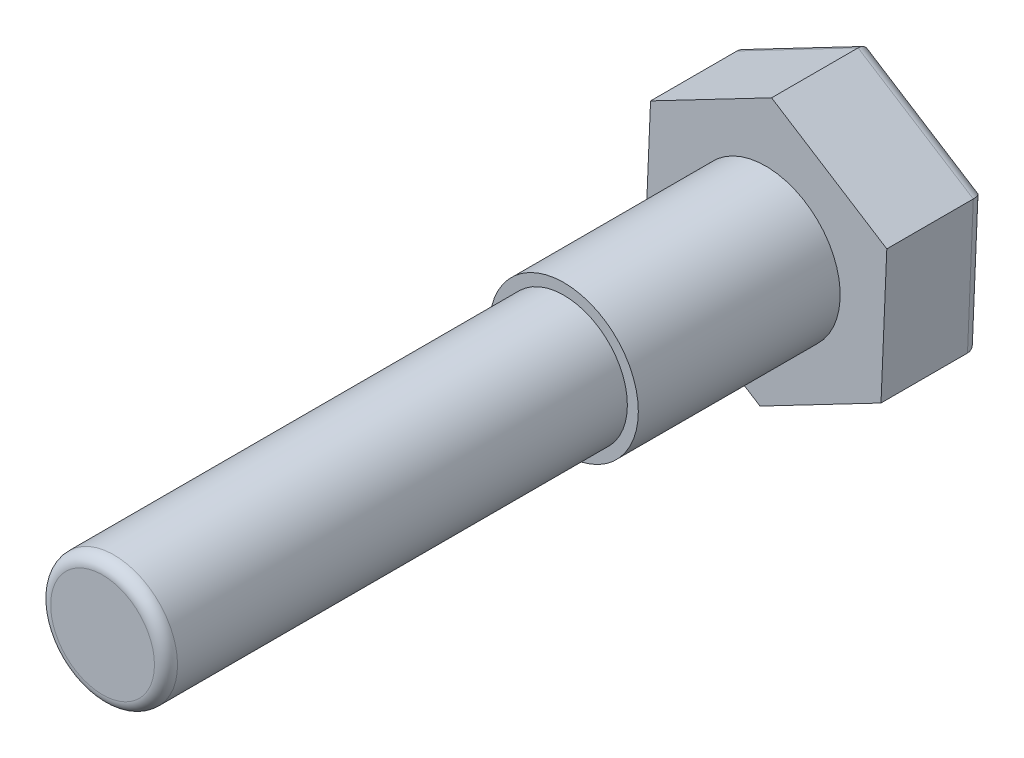
from build123d import *

# Parameters (mm, degrees)
EXTRUDE_376_DEPTH = 17
SKETCH_2_R        = 12.9
EXTRUDE_1_DEPTH   = 35
FILLET_3_R        = 2
SKETCH_3_R        = 11
EXTRUDE_2_DEPTH   = 80
FILLET_4_R        = 2


with BuildPart() as part:
    # 草图1 → Extrude 376 (new body)
    with BuildSketch(Plane.XY):
        Polygon((20.984201837, 10.954296262), (1.005402075, 23.65), (-19.978799762, 12.695703738), (-20.984201837, -10.954296262), (-1.005402075, -23.65), (19.978799762, -12.695703738), align=None)
    extrude(amount=EXTRUDE_376_DEPTH)

    # 草图2 → 凸台-拉伸1 (add)
    with BuildSketch(Plane.XY.offset(17)):
        with Locations(Location((0, 0, 0), (0, 0, 180))):
            Circle(SKETCH_2_R)
    extrude(amount=EXTRUDE_1_DEPTH)

    # 圆角3
    fillet_3_edges = [part.edges().sort_by_distance(p)[0] for p in [
        (9.486698843, -18.172851869, 0),
        (-10.994801956, -17.302148131, 0),
        (-20.4815008, 0.870703738, 0),
        (-9.486698843, 18.172851869, 0),
        (10.994801956, 17.302148131, 0),
        (20.4815008, -0.870703738, 0),
    ]]
    fillet(fillet_3_edges, radius=FILLET_3_R)

    # 草图3 → 凸台-拉伸2 (add)
    with BuildSketch(Plane.XY.offset(52)):
        Circle(SKETCH_3_R)
    extrude(amount=EXTRUDE_2_DEPTH)

    # 圆角4
    fillet_4_edges = [part.edges().sort_by_distance(p)[0] for p in [
        (-11, 0, 132),
    ]]
    fillet(fillet_4_edges, radius=FILLET_4_R)


solid = part.part
